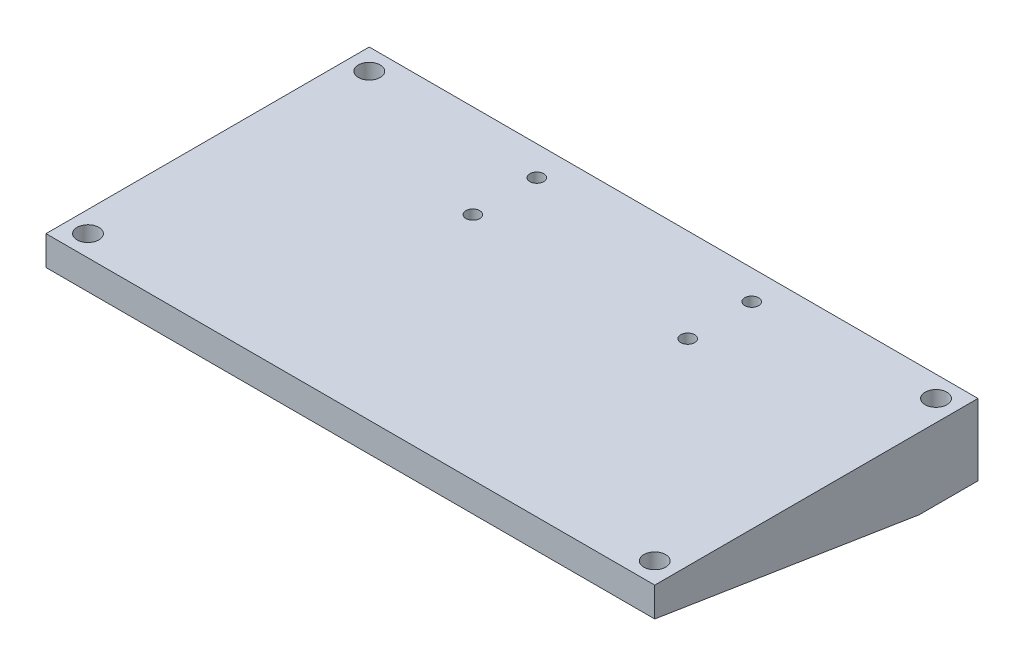
from build123d import *

# Parameters (mm, degrees)
SKETCH5_W           = 145
SKETCH5_H           = 77
BOSS_EXTRUDE2_DEPTH = 17
CHAMFER2_SIZE       = 63
CHAMFER2_SIZE2      = 10
SKETCH1_R           = 2.6
SKETCH1_R_2         = 1.65
CUT_EXTRUDE1_DEPTH  = 5


with BuildPart() as part:
    # Sketch5 → Boss-Extrude2 (new body)
    with BuildSketch(Plane(origin=(0, 0, 0), x_dir=(1, 0, 0), z_dir=(0, 1, 0))):
        with Locations((72.5, 38.5)):
            Rectangle(SKETCH5_W, SKETCH5_H)
    extrude(amount=BOSS_EXTRUDE2_DEPTH)

    # Chamfer2
    chamfer2_edges = [part.edges().sort_by_distance(p)[0] for p in [
        (72.5, 0, 0),
    ]]
    chamfer2_side = [part.faces().sort_by_distance(p)[0] for p in [
        (72.5, 0, -38.5),
    ]]
    chamfer(chamfer2_edges, length=CHAMFER2_SIZE, length2=CHAMFER2_SIZE2, reference=chamfer2_side[0])

    # Sketch1 → Cut-Extrude1 (cut)
    with BuildSketch(Plane(origin=(0, 17, 0), x_dir=(1, 0, 0), z_dir=(0, 1, 0))):
        with Locations(Location((5, 72, 0), (0, 0, 270))):
            Circle(SKETCH1_R)
        with Locations(Location((5, 5, 0), (0, 0, 270))):
            Circle(SKETCH1_R)
        with Locations(Location((140, 5, 0), (0, 0, 270))):
            Circle(SKETCH1_R)
        with Locations(Location((140, 72, 0), (0, 0, 270))):
            Circle(SKETCH1_R)
        with Locations(Location((46.91, 70, 0), (0, 0, 270))):
            Circle(SKETCH1_R_2)
        with Locations(Location((46.91, 54.76, 0), (0, 0, 270))):
            Circle(SKETCH1_R_2)
        with Locations(Location((98.09, 70, 0), (0, 0, 270))):
            Circle(SKETCH1_R_2)
        with Locations(Location((98.09, 54.76, 0), (0, 0, 270))):
            Circle(SKETCH1_R_2)
    extrude(amount=-CUT_EXTRUDE1_DEPTH, mode=Mode.SUBTRACT)


solid = part.part
